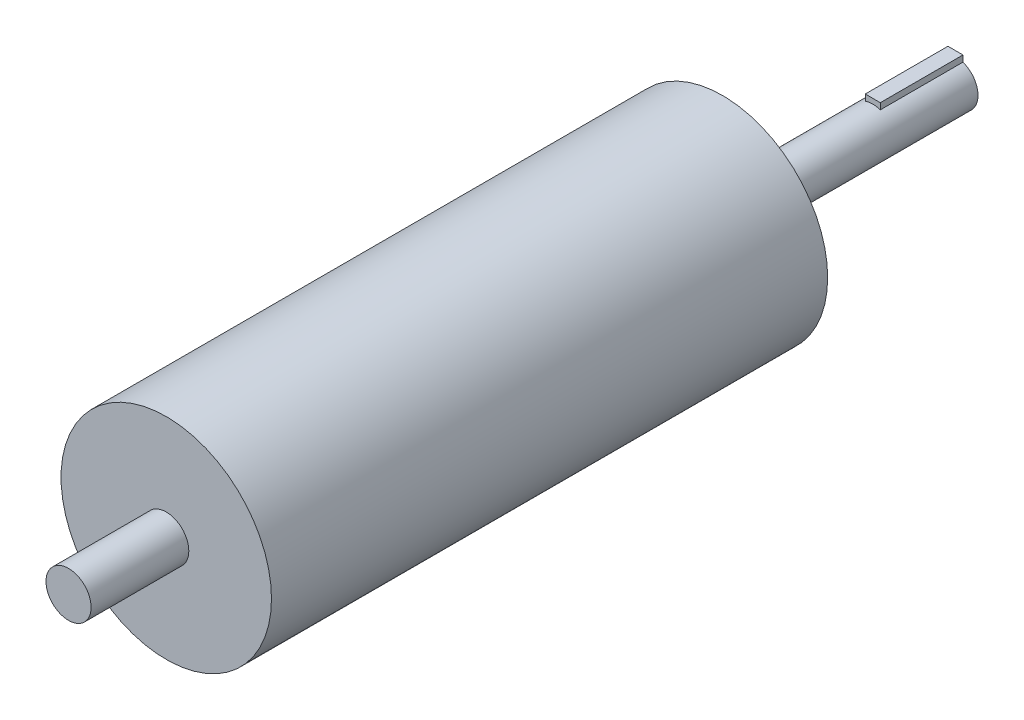
from build123d import *

# Parameters (mm, degrees)
SKETCH1_R           = 70
BOSS_EXTRUDE1_DEPTH = 370
SKETCH4_R           = 10
BOSS_EXTRUDE2_DEPTH = 80
BOSS_EXTRUDE3_START = 100
SKETCH5_R           = 10
BOSS_EXTRUDE3_DEPTH = 100
CUT_EXTRUDE1_START  = -15
SKETCH6_R           = 10
CUT_EXTRUDE1_DEPTH  = 15
BOSS_EXTRUDE4_DEPTH = 25
SKETCH8_R           = 15
BOSS_EXTRUDE5_DEPTH = 535
BOSS_EXTRUDE7_DEPTH = 55
BOSS_EXTRUDE8_START = 55
SKETCH10_R          = 15
BOSS_EXTRUDE8_DEPTH = 55


with BuildPart() as part:
    # Sketch1 → Boss-Extrude1 (new body)
    with BuildSketch(Plane.XY):
        Circle(SKETCH1_R)
    extrude(amount=BOSS_EXTRUDE1_DEPTH)

    # Sketch4 → Boss-Extrude2 (add)
    with BuildSketch(Plane.XY.offset(370)):
        Circle(SKETCH4_R)
    extrude(amount=BOSS_EXTRUDE2_DEPTH)

    # Sketch5 → Boss-Extrude3 (add)
    with BuildSketch(Plane(origin=(0, 0, 0), x_dir=(-1, 0, 0), z_dir=(0, 0, -1)).offset(BOSS_EXTRUDE3_START)):
        with Locations(Location((0, 0, 0), (0, 0, 180))):
            Circle(SKETCH5_R)
    extrude(amount=-BOSS_EXTRUDE3_DEPTH)

    # Sketch6 → Cut-Extrude1 (cut)
    with BuildSketch(Plane.XY.offset(450).offset(CUT_EXTRUDE1_START)):
        Circle(SKETCH6_R)
    extrude(amount=CUT_EXTRUDE1_DEPTH, mode=Mode.SUBTRACT)

    # Sketch7 → Boss-Extrude4 (add)
    with BuildSketch(Plane(origin=(0, 0, -100), x_dir=(-1, 0, 0), z_dir=(0, 0, -1))):
        with BuildLine():
            Line((5, 8.660254038), (5, 12.820254038))
            Line((5, 12.820254038), (-5, 12.820254038))
            Line((-5, 12.820254038), (-5, 8.660254038))
            ThreePointArc((-5, 8.660254038), (0, 10), (5, 8.660254038))
        make_face()
    extrude(amount=-BOSS_EXTRUDE4_DEPTH)

    # Sketch8 → Boss-Extrude5 (add)
    with BuildSketch(Plane(origin=(0, 0, -100), x_dir=(-1, 0, 0), z_dir=(0, 0, -1))):
        Circle(SKETCH8_R)
    extrude(amount=-BOSS_EXTRUDE5_DEPTH)



with BuildPart() as body_2:
    # Sketch9 → Boss-Extrude7 (new body)
    with BuildSketch(Plane(origin=(0, 0, -100), x_dir=(-1, 0, 0), z_dir=(0, 0, -1))):
        with BuildLine():
            Line((-5, 14.142135624), (-5, 18.302135624))
            Line((-5, 18.302135624), (5, 18.302135624))
            Line((5, 18.302135624), (5, 14.142135624))
            ThreePointArc((5, 14.142135624), (0, 15), (-5, 14.142135624))
        make_face()
    extrude(amount=BOSS_EXTRUDE7_DEPTH)


with BuildPart() as part_1:
    add(part.part)

    add(body_2.part)  # Boss-Extrude8 merges body 2
    # Sketch10 → Boss-Extrude8 (add)
    with BuildSketch(Plane(origin=(0, 0, -100), x_dir=(-1, 0, 0), z_dir=(0, 0, -1)).offset(BOSS_EXTRUDE8_START)):
        with Locations(Location((0, 0, 0), (0, 0, 70.528779366))):
            Circle(SKETCH10_R)
    extrude(amount=-BOSS_EXTRUDE8_DEPTH)


solid = part_1.part
